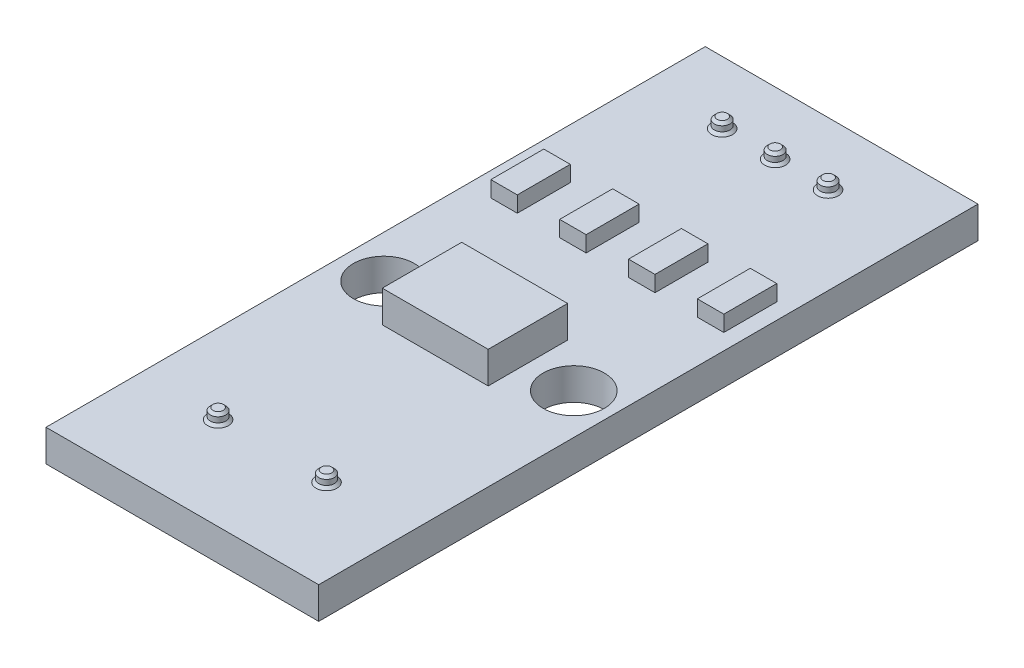
from build123d import *

# Parameters (mm, degrees)
SKETCH2_W                = 13.081
SKETCH2_H                = 31.623
BOSS_EXTRUDE1_DEPTH      = 1.524
BOSS_EXTRUDE3_DEPTH      = 0.508
BOSS_EXTRUDE3_DEPTH_BACK = 4.064
SKETCH3_R                = 0.375
CHAMFER2_SIZE            = 0.127
SKETCH4_W                = 1.27
SKETCH4_H                = 2.54
BOSS_EXTRUDE4_DEPTH      = 0.762
SKETCH5_W                = 5.08
SKETCH5_H                = 3.81
BOSS_EXTRUDE5_DEPTH      = 1.524
SKETCH6_R                = 1.462847535
SKETCH6_R_2              = 1.470158192
CUT_EXTRUDE1_DEPTH       = 1.524


with BuildPart() as part:
    # Sketch2 → Boss-Extrude1 (new body)
    with BuildSketch(Plane(origin=(0, 0, 0), x_dir=(1, 0, 0), z_dir=(0, 1, 0))):
        with Locations((6.5405, 15.8115)):
            Rectangle(SKETCH2_W, SKETCH2_H)
    extrude(amount=BOSS_EXTRUDE1_DEPTH)

    # Sketch3 → Boss-Extrude3 (add, two sides: drawn at the far end of the back side and taken through both)
    with BuildSketch(Plane(origin=(0, 1.524, 0), x_dir=(1, 0, 0), z_dir=(0, 1, 0)).offset(-BOSS_EXTRUDE3_DEPTH_BACK)):
        with Locations(Location((3.81, 28.623, 0), (0, 0, 90))):
            Circle(SKETCH3_R)
        with Locations(Location((6.35, 28.623, 0), (0, 0, 90))):
            Circle(SKETCH3_R)
        with Locations(Location((8.89, 28.623, 0), (0, 0, 90))):
            Circle(SKETCH3_R)
        with Locations(Location((3.81, 4.445, 0), (0, 0, 90))):
            Circle(SKETCH3_R)
        with Locations(Location((9.01, 4.445, 0), (0, 0, 90))):
            Circle(SKETCH3_R)
    extrude(amount=BOSS_EXTRUDE3_DEPTH + BOSS_EXTRUDE3_DEPTH_BACK)

    # Chamfer2
    chamfer2_edges = [part.edges().sort_by_distance(p)[0] for p in [
        (3.81, 1.524, -28.248),
        (3.81, 0, -28.248),
        (3.81, -2.54, -28.248),
        (3.81, 2.032, -28.248),
        (6.35, 1.524, -28.248),
        (6.35, 0, -28.248),
        (6.35, -2.54, -28.248),
        (6.35, 2.032, -28.248),
        (8.89, 1.524, -28.248),
        (8.89, 0, -28.248),
        (8.89, -2.54, -28.248),
        (8.89, 2.032, -28.248),
        (3.81, 1.524, -4.07),
        (3.81, -2.54, -4.07),
        (3.81, 2.032, -4.07),
        (9.01, 1.524, -4.07),
        (9.01, -2.54, -4.07),
        (9.01, 2.032, -4.07),
    ]]
    chamfer(chamfer2_edges, length=CHAMFER2_SIZE)

    # Sketch4 → Boss-Extrude4 (add)
    with BuildSketch(Plane(origin=(0, 1.524, 0), x_dir=(1, 0, 0), z_dir=(0, 1, 0))):
        with Locations((1.778, 21.463)):
            Rectangle(SKETCH4_W, SKETCH4_H)
        with Locations((5.08, 21.463)):
            Rectangle(SKETCH4_W, SKETCH4_H)
        with Locations((8.382, 21.463)):
            Rectangle(SKETCH4_W, SKETCH4_H)
        with Locations((11.684, 21.463)):
            Rectangle(SKETCH4_W, SKETCH4_H)
    extrude(amount=BOSS_EXTRUDE4_DEPTH)

    # Sketch5 → Boss-Extrude5 (add)
    with BuildSketch(Plane(origin=(0, 1.524, 0), x_dir=(1, 0, 0), z_dir=(0, 1, 0))):
        with Locations((6.35, 14.224)):
            Rectangle(SKETCH5_W, SKETCH5_H)
    extrude(amount=BOSS_EXTRUDE5_DEPTH)

    # Sketch6 → Cut-Extrude1 (cut)
    with BuildSketch(Plane(origin=(0, 1.524, 0), x_dir=(1, 0, 0), z_dir=(0, 1, 0))):
        with Locations(Location((2.030479475, 14.174875331, 0), (0, 0, 270))):
            Circle(SKETCH6_R)
        with Locations(Location((11.138543977, 14.174875331, 0), (0, 0, 270))):
            Circle(SKETCH6_R_2)
    extrude(amount=-CUT_EXTRUDE1_DEPTH, mode=Mode.SUBTRACT)


solid = part.part
